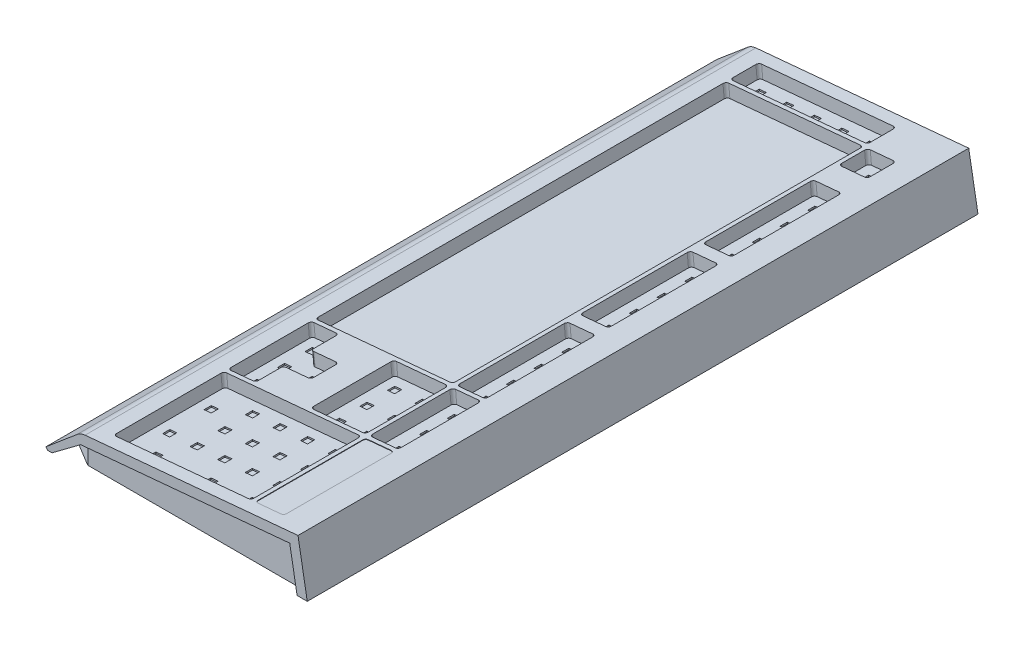
from build123d import *

# Parameters (mm, degrees)
BOSS_EXTRUDE1_DEPTH = 459
BOSS_EXTRUDE3_DEPTH = 5
BOSS_EXTRUDE5_DEPTH = 5
BOSS_EXTRUDE6_DEPTH = 459
CUT_EXTRUDE3_REACH  = 477.193
BOSS_EXTRUDE7_DEPTH = 469
BOSS_EXTRUDE8_DEPTH = 464
CUT_EXTRUDE10_DEPTH = 5
CUT_EXTRUDE12_DEPTH = 0.3
CUT_EXTRUDE13_DEPTH = 9
FILLET5_R           = 10
SKETCH78_W          = 5
SKETCH78_H          = 5
CUT_EXTRUDE42_DEPTH = 1


with BuildPart() as part:
    # Sketch1 → Boss-Extrude1 (new body)
    with BuildSketch(Plane.XY):
        Polygon((-76, 22), (76, 36), (76, 0), (-76, 0), align=None)
    extrude(amount=BOSS_EXTRUDE1_DEPTH)

    # Sketch4 → Boss-Extrude3 (add)
    with BuildSketch(Plane.XY.offset(459)):
        Polygon((70.225311647, 28.438491687), (75.360399781, -0.684040287), (82.468386064, -0.684040287), (76, 36), (-76, 22), (-76, 14.970370878), align=None)
    extrude(amount=BOSS_EXTRUDE3_DEPTH)

    # Sketch6 → Boss-Extrude5 (add)
    with BuildSketch(Plane(origin=(0, 0, 0), x_dir=(-1, 0, 0), z_dir=(0, 0, -1))):
        Polygon((-69, 0), (-69, 28.325634036), (76, 14.970370878), (76, 22), (-76, 36), (-76, 0), align=None)
    extrude(amount=BOSS_EXTRUDE5_DEPTH)

    # Sketch10 → Boss-Extrude6 (add)
    with BuildSketch(Plane.XY.offset(459)):
        Polygon((-76, 0), (-96, 0), (-76, 14.970370878), align=None)
    extrude(amount=-BOSS_EXTRUDE6_DEPTH)

    # Sketch11 → Cut-Extrude3 (cut, up to next)
    with BuildSketch(Plane.XZ, mode=Mode.PRIVATE) as cut_extrude3_sk1:
        Polygon((-76, 459), (-96, 447), (-96, 459), align=None)
    cut_extrude3_tool1 = extrude(cut_extrude3_sk1.sketch, amount=-CUT_EXTRUDE3_REACH, mode=Mode.PRIVATE) & part.part
    # Sketch11 → Cut-Extrude3 (cut, up to next)
    with BuildSketch(Plane.XZ, mode=Mode.PRIVATE) as cut_extrude3_sk2:
        Polygon((-76, 0), (-96, 12), (-96, 0), align=None)
    cut_extrude3_tool2 = extrude(cut_extrude3_sk2.sketch, amount=-CUT_EXTRUDE3_REACH, mode=Mode.PRIVATE) & part.part
    add(cut_extrude3_tool1.solids().sort_by_distance((-89.333333, 0, 455))[0], mode=Mode.SUBTRACT)
    add(cut_extrude3_tool2.solids().sort_by_distance((-89.333333, 0, 4))[0], mode=Mode.SUBTRACT)

    # Sketch12 → Boss-Extrude7 (add)
    with BuildSketch(Plane.XY.offset(464)):
        Polygon((-76, 14.970370878), (-96, 0), (-99, 0), (-100.203362029, 1.607658272), (-76, 22), align=None)
    extrude(amount=-BOSS_EXTRUDE7_DEPTH)

    # Sketch19 → Boss-Extrude8 (add)
    with BuildSketch(Plane(origin=(0, 0, 459), x_dir=(-1, 0, 0), z_dir=(0, 0, -1))):
        Polygon((-82.468386064, -0.684040287), (-75.360399781, -0.684040287), (-75.239785022, 0), (-76, 0), (-76, 36), align=None)
    extrude(amount=BOSS_EXTRUDE8_DEPTH)

    # Sketch20 → Cut-Extrude10 (cut)
    with BuildSketch(Plane(origin=(0, 0, -5), x_dir=(-1, 0, 0), z_dir=(0, 0, -1))):
        Polygon((-69, 28.325634036), (-73.994573526, 0), (-69, 0), align=None)
    extrude(amount=-CUT_EXTRUDE10_DEPTH, mode=Mode.SUBTRACT)

    # Sketch22 → Cut-Extrude12 (cut)
    with BuildSketch(Plane(origin=(-2.648583691, 28.756051502, 0), x_dir=(0.9957851087622359, 0.09171704949125857, 0), z_dir=(-0.09171704949125857, 0.9957851087622359, 0))):
        with BuildLine():
            Line((57.981482048, -378), (41.981482048, -378))
            ThreePointArc((41.981482048, -378), (40.567268485, -378.585786438), (39.981482048, -380))
            Line((39.981482048, -380), (39.981482048, -453))
            ThreePointArc((39.981482048, -453), (40.567268485, -454.414213562), (41.981482048, -455))
            Line((41.981482048, -455), (57.981482048, -455))
            ThreePointArc((57.981482048, -455), (59.39569561, -454.414213562), (59.981482048, -453))
            Line((59.981482048, -453), (59.981482048, -380))
            ThreePointArc((59.981482048, -380), (59.39569561, -378.585786438), (57.981482048, -378))
        make_face()
    extrude(amount=-CUT_EXTRUDE12_DEPTH, mode=Mode.SUBTRACT)

    # Sketch23 → Cut-Extrude13 (cut)
    with BuildSketch(Plane(origin=(-2.648583691, 28.756051502, 0), x_dir=(0.9957851087622359, 0.09171704949125857, 0), z_dir=(-0.09171704949125857, 0.9957851087622359, 0))):
        with BuildLine():
            Line((36.981482048, -380), (36.981482048, -453))
            ThreePointArc((36.981482048, -453), (36.39569561, -454.414213562), (34.981482048, -455))
            Line((34.981482048, -455), (-57.438517952, -455))
            ThreePointArc((-57.438517952, -455), (-58.852731515, -454.414213562), (-59.438517952, -453))
            Line((-59.438517952, -453), (-59.438517952, -380))
            ThreePointArc((-59.438517952, -380), (-58.852731515, -378.585786438), (-57.438517952, -378))
            Line((-57.438517952, -378), (34.981482048, -378))
            ThreePointArc((34.981482048, -378), (36.39569561, -378.585786438), (36.981482048, -380))
        make_face()
        with BuildLine():
            Line((57.981482048, -375), (41.981482048, -375))
            ThreePointArc((41.981482048, -375), (40.567268485, -374.414213562), (39.981482048, -373))
            Line((39.981482048, -373), (39.981482048, -319))
            ThreePointArc((39.981482048, -319), (40.567268485, -317.585786438), (41.981482048, -317))
            Line((41.981482048, -317), (57.981482048, -317))
            ThreePointArc((57.981482048, -317), (59.39569561, -317.585786438), (59.981482048, -319))
            Line((59.981482048, -319), (59.981482048, -373))
            ThreePointArc((59.981482048, -373), (59.39569561, -374.414213562), (57.981482048, -375))
        make_face()
        with BuildLine():
            Line((34.981482048, -375), (0.551482048, -375))
            ThreePointArc((0.551482048, -375), (-0.862731515, -374.414213562), (-1.448517952, -373))
            Line((-1.448517952, -373), (-1.448517952, -319))
            ThreePointArc((-1.448517952, -319), (-0.862731515, -317.585786438), (0.551482048, -317))
            Line((0.551482048, -317), (34.981482048, -317))
            ThreePointArc((34.981482048, -317), (36.39569561, -317.585786438), (36.981482048, -319))
            Line((36.981482048, -319), (36.981482048, -373))
            ThreePointArc((36.981482048, -373), (36.39569561, -374.414213562), (34.981482048, -375))
        make_face()
        with BuildLine():
            Line((-59.438517952, -373), (-59.438517952, -319))
            ThreePointArc((-59.438517952, -319), (-58.852731515, -317.585786438), (-57.438517952, -317))
            Line((-57.438517952, -317), (-42.108517952, -317))
            ThreePointArc((-42.108517952, -317), (-40.69430439, -317.585786438), (-40.108517952, -319))
            Line((-40.108517952, -319), (-40.108517952, -334.333333333))
            ThreePointArc((-40.108517952, -334.333333333), (-39.522731515, -335.747546896), (-38.108517952, -336.333333333))
            Line((-38.108517952, -336.333333333), (-22.778517952, -336.333333333))
            ThreePointArc((-22.778517952, -336.333333333), (-21.36430439, -336.919119771), (-20.778517952, -338.333333333))
            Line((-20.778517952, -338.333333333), (-20.778517952, -353.666666667))
            ThreePointArc((-20.778517952, -353.666666667), (-21.36430439, -355.080880229), (-22.778517952, -355.666666667))
            Line((-22.778517952, -355.666666667), (-38.108517952, -355.666666667))
            ThreePointArc((-38.108517952, -355.666666667), (-39.522731515, -356.252453104), (-40.108517952, -357.666666667))
            Line((-40.108517952, -357.666666667), (-40.108517952, -373))
            ThreePointArc((-40.108517952, -373), (-40.69430439, -374.414213562), (-42.108517952, -375))
            Line((-42.108517952, -375), (-57.438517952, -375))
            ThreePointArc((-57.438517952, -375), (-58.852731515, -374.414213562), (-59.438517952, -373))
        make_face()
        with BuildLine():
            Line((57.981482048, -314), (41.981482048, -314))
            ThreePointArc((41.981482048, -314), (40.567268485, -313.414213562), (39.981482048, -312))
            Line((39.981482048, -312), (39.981482048, -239))
            ThreePointArc((39.981482048, -239), (40.567268485, -237.585786438), (41.981482048, -237))
            Line((41.981482048, -237), (57.981482048, -237))
            ThreePointArc((57.981482048, -237), (59.39569561, -237.585786438), (59.981482048, -239))
            Line((59.981482048, -239), (59.981482048, -312))
            ThreePointArc((59.981482048, -312), (59.39569561, -313.414213562), (57.981482048, -314))
        make_face()
        with BuildLine():
            Line((57.981482048, -228), (41.981482048, -228))
            ThreePointArc((41.981482048, -228), (40.567268485, -227.414213562), (39.981482048, -226))
            Line((39.981482048, -226), (39.981482048, -153))
            ThreePointArc((39.981482048, -153), (40.567268485, -151.585786438), (41.981482048, -151))
            Line((41.981482048, -151), (57.981482048, -151))
            ThreePointArc((57.981482048, -151), (59.39569561, -151.585786438), (59.981482048, -153))
            Line((59.981482048, -153), (59.981482048, -226))
            ThreePointArc((59.981482048, -226), (59.39569561, -227.414213562), (57.981482048, -228))
        make_face()
        with BuildLine():
            Line((57.981482048, -142), (41.981482048, -142))
            ThreePointArc((41.981482048, -142), (40.567268485, -141.414213562), (39.981482048, -140))
            Line((39.981482048, -140), (39.981482048, -67))
            ThreePointArc((39.981482048, -67), (40.567268485, -65.585786438), (41.981482048, -65))
            Line((41.981482048, -65), (57.981482048, -65))
            ThreePointArc((57.981482048, -65), (59.39569561, -65.585786438), (59.981482048, -67))
            Line((59.981482048, -67), (59.981482048, -140))
            ThreePointArc((59.981482048, -140), (59.39569561, -141.414213562), (57.981482048, -142))
        make_face()
        with BuildLine():
            Line((57.981482048, -27), (41.981482048, -27))
            ThreePointArc((41.981482048, -27), (40.567268485, -27.585786438), (39.981482048, -29))
            Line((39.981482048, -29), (39.981482048, -45))
            ThreePointArc((39.981482048, -45), (40.567268485, -46.414213562), (41.981482048, -47))
            Line((41.981482048, -47), (57.981482048, -47))
            ThreePointArc((57.981482048, -47), (59.39569561, -46.414213562), (59.981482048, -45))
            Line((59.981482048, -45), (59.981482048, -29))
            ThreePointArc((59.981482048, -29), (59.39569561, -27.585786438), (57.981482048, -27))
        make_face()
        with BuildLine():
            Line((34.981482048, -4), (-57.438517952, -4))
            ThreePointArc((-57.438517952, -4), (-58.852731515, -4.585786438), (-59.438517952, -6))
            Line((-59.438517952, -6), (-59.438517952, -22))
            ThreePointArc((-59.438517952, -22), (-58.852731515, -23.414213562), (-57.438517952, -24))
            Line((-57.438517952, -24), (34.981482048, -24))
            ThreePointArc((34.981482048, -24), (36.39569561, -23.414213562), (36.981482048, -22))
            Line((36.981482048, -22), (36.981482048, -6))
            ThreePointArc((36.981482048, -6), (36.39569561, -4.585786438), (34.981482048, -4))
        make_face()
        with BuildLine():
            Line((34.981482048, -27), (-57.438517952, -27))
            ThreePointArc((-57.438517952, -27), (-58.852731515, -27.585786438), (-59.438517952, -29))
            Line((-59.438517952, -29), (-59.438517952, -312))
            ThreePointArc((-59.438517952, -312), (-58.852731515, -313.414213562), (-57.438517952, -314))
            Line((-57.438517952, -314), (34.981482048, -314))
            ThreePointArc((34.981482048, -314), (36.39569561, -313.414213562), (36.981482048, -312))
            Line((36.981482048, -312), (36.981482048, -29))
            ThreePointArc((36.981482048, -29), (36.39569561, -27.585786438), (34.981482048, -27))
        make_face()
    extrude(amount=-CUT_EXTRUDE13_DEPTH, mode=Mode.SUBTRACT)

    # Fillet5
    fillet5_edges = [part.edges().sort_by_distance(p)[0] for p in [
        (-76, 22, 229.5),
    ]]
    fillet(fillet5_edges, radius=FILLET5_R)

    # Sketch78 → Cut-Extrude42 (cut)
    with BuildSketch(Plane(origin=(-1.823130246, 19.793985523, 0), x_dir=(0.9957851087622359, 0.09171704949125857, 0), z_dir=(-0.09171704949125857, 0.9957851087622359, 0))):
        with Locations((-30.443517952, -346)):
            Rectangle(SKETCH78_W, SKETCH78_H)
        with Locations((-49.773517952, -326.666666667)):
            Rectangle(SKETCH78_W, SKETCH78_H)
        with Locations((-49.773517952, -346)):
            Rectangle(SKETCH78_W, SKETCH78_H)
        with Locations((-49.773517952, -365.333333333)):
            Rectangle(SKETCH78_W, SKETCH78_H)
        with Locations((27.431482048, -346)):
            Rectangle(SKETCH78_W, SKETCH78_H)
        with Locations((8.101482048, -346)):
            Rectangle(SKETCH78_W, SKETCH78_H)
        with Locations((27.431482048, -365.333333333)):
            Rectangle(SKETCH78_W, SKETCH78_H)
        with Locations((27.431482048, -326.666666667)):
            Rectangle(SKETCH78_W, SKETCH78_H)
        with Locations((8.101482048, -326.666666667)):
            Rectangle(SKETCH78_W, SKETCH78_H)
        with Locations((8.101482048, -365.333333333)):
            Rectangle(SKETCH78_W, SKETCH78_H)
        with Locations((49.981482048, -326.666666667)):
            Rectangle(SKETCH78_W, SKETCH78_H)
        with Locations((49.981482048, -346)):
            Rectangle(SKETCH78_W, SKETCH78_H)
        with Locations((49.981482048, -365.333333333)):
            Rectangle(SKETCH78_W, SKETCH78_H)
        with Locations((49.981482048, -37)):
            Rectangle(SKETCH78_W, SKETCH78_H)
        with Locations((27.431482048, -14)):
            Rectangle(SKETCH78_W, SKETCH78_H)
        with Locations((8.101482048, -14)):
            Rectangle(SKETCH78_W, SKETCH78_H)
        with Locations((-11.228517952, -14)):
            Rectangle(SKETCH78_W, SKETCH78_H)
        with Locations((-30.558517952, -14)):
            Rectangle(SKETCH78_W, SKETCH78_H)
        with Locations((-49.888517952, -14)):
            Rectangle(SKETCH78_W, SKETCH78_H)
        with Locations((-11.228517952, -426.17)):
            Rectangle(SKETCH78_W, SKETCH78_H)
        with Locations((49.981482048, -74.505)):
            Rectangle(SKETCH78_W, SKETCH78_H)
        with Locations((49.981482048, -93.835)):
            Rectangle(SKETCH78_W, SKETCH78_H)
        with Locations((49.981482048, -113.165)):
            Rectangle(SKETCH78_W, SKETCH78_H)
        with Locations((49.981482048, -132.495)):
            Rectangle(SKETCH78_W, SKETCH78_H)
        with Locations((49.981482048, -160.505)):
            Rectangle(SKETCH78_W, SKETCH78_H)
        with Locations((49.981482048, -179.835)):
            Rectangle(SKETCH78_W, SKETCH78_H)
        with Locations((49.981482048, -199.165)):
            Rectangle(SKETCH78_W, SKETCH78_H)
        with Locations((49.981482048, -218.495)):
            Rectangle(SKETCH78_W, SKETCH78_H)
        with Locations((49.981482048, -246.505)):
            Rectangle(SKETCH78_W, SKETCH78_H)
        with Locations((49.981482048, -265.835)):
            Rectangle(SKETCH78_W, SKETCH78_H)
        with Locations((49.981482048, -285.165)):
            Rectangle(SKETCH78_W, SKETCH78_H)
        with Locations((49.981482048, -304.495)):
            Rectangle(SKETCH78_W, SKETCH78_H)
        with Locations((-11.228517952, -406.84)):
            Rectangle(SKETCH78_W, SKETCH78_H)
        with Locations((27.431482048, -387.51)):
            Rectangle(SKETCH78_W, SKETCH78_H)
        with Locations((27.431482048, -406.84)):
            Rectangle(SKETCH78_W, SKETCH78_H)
        with Locations((27.431482048, -426.17)):
            Rectangle(SKETCH78_W, SKETCH78_H)
        with Locations((27.431482048, -445.5)):
            Rectangle(SKETCH78_W, SKETCH78_H)
        with Locations((-11.228517952, -387.51)):
            Rectangle(SKETCH78_W, SKETCH78_H)
        with Locations((8.101482048, -387.51)):
            Rectangle(SKETCH78_W, SKETCH78_H)
        with Locations((8.101482048, -406.84)):
            Rectangle(SKETCH78_W, SKETCH78_H)
        with Locations((8.101482048, -426.17)):
            Rectangle(SKETCH78_W, SKETCH78_H)
        with Locations((-1.563517952, -445.5)):
            Rectangle(SKETCH78_W, SKETCH78_H)
        with Locations((-30.558517952, -387.51)):
            Rectangle(SKETCH78_W, SKETCH78_H)
        with Locations((-30.558517952, -406.84)):
            Rectangle(SKETCH78_W, SKETCH78_H)
        with Locations((-30.558517952, -426.17)):
            Rectangle(SKETCH78_W, SKETCH78_H)
        with Locations((-40.223517952, -445.5)):
            Rectangle(SKETCH78_W, SKETCH78_H)
        with Locations((-49.888517952, -426.17)):
            Rectangle(SKETCH78_W, SKETCH78_H)
        with Locations((-49.888517952, -397.175)):
            Rectangle(SKETCH78_W, SKETCH78_H)
    extrude(amount=-CUT_EXTRUDE42_DEPTH, mode=Mode.SUBTRACT)


solid = part.part
